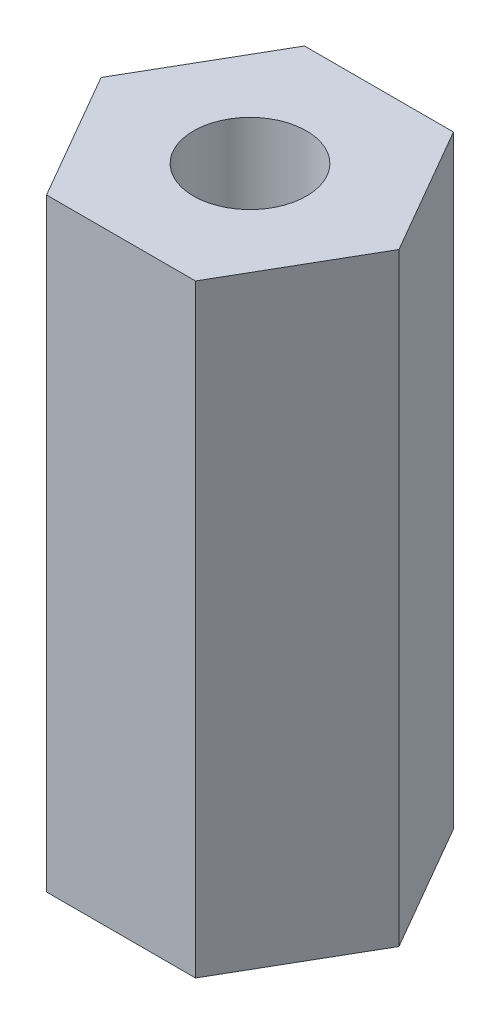
from build123d import *

# Parameters (mm, degrees)
BOSS_EXTRUDE1_DEPTH          = 10.95
F_2_05_2_05_DIAMETER_HOLE1_D = 2.05


with BuildPart() as part:
    # Sketch1 → Boss-Extrude1 (new body)
    with BuildSketch(Plane(origin=(0, 0, 0), x_dir=(1, 0, 0), z_dir=(0, 1, 0))):
        Polygon((2.70199926, 0), (1.35099963, 2.34), (-1.35099963, 2.34), (-2.70199926, 0), (-1.35099963, -2.34), (1.35099963, -2.34), align=None)
    extrude(amount=BOSS_EXTRUDE1_DEPTH)

    # Ø2.05 (2.05) Diameter Hole1 (through all)
    with Locations(Plane(origin=(0, 10.95, 0), x_dir=(1, 0, 0), z_dir=(0, 1, 0))):
        with Locations((0, 0)):
            Hole(F_2_05_2_05_DIAMETER_HOLE1_D / 2)


solid = part.part
